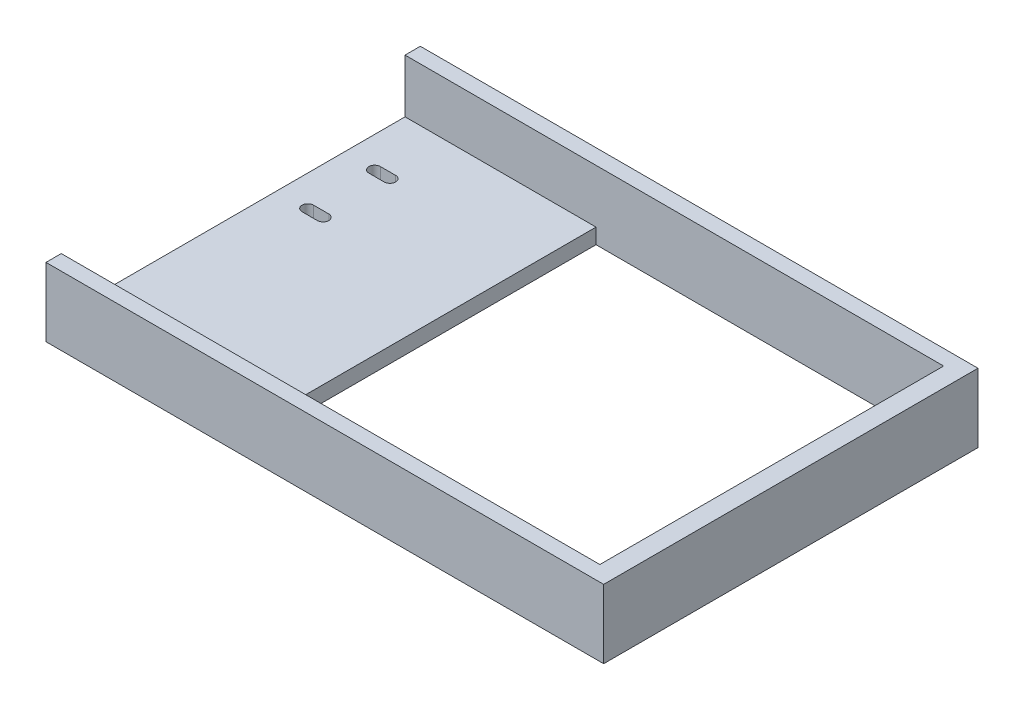
from build123d import *

# Parameters (mm, degrees)
SKETCH_1_W          = 146
SKETCH_1_H          = 98
EXTRUDE_1_DEPTH     = 18
SKETCH_2_W          = 141
SKETCH_2_H          = 90
CUT_EXTRUDE_1_DEPTH = 14
SKETCH_3_W          = 91
SKETCH_3_H          = 90
CUT_EXTRUDE_2_DEPTH = 17
CUT_EXTRUDE_3_DEPTH = 17


with BuildPart() as part:
    # 草图1 → 凸台-拉伸1 (new body)
    with BuildSketch(Plane(origin=(0, 0, 0), x_dir=(1, 0, 0), z_dir=(0, 1, 0))):
        with Locations((-12.96875, -2.625)):
            Rectangle(SKETCH_1_W, SKETCH_1_H)
    extrude(amount=EXTRUDE_1_DEPTH)

    # 草图2 → 切除-拉伸1 (cut)
    with BuildSketch(Plane(origin=(0, 18, 0), x_dir=(1, 0, 0), z_dir=(0, 1, 0))):
        with Locations((-15.46875, -2.625)):
            Rectangle(SKETCH_2_W, SKETCH_2_H)
    extrude(amount=-CUT_EXTRUDE_1_DEPTH, mode=Mode.SUBTRACT)

    # 草图3 → 切除-拉伸2 (cut)
    with BuildSketch(Plane(origin=(0, 4, 0), x_dir=(1, 0, 0), z_dir=(0, 1, 0))):
        with Locations((9.53125, -2.625)):
            Rectangle(SKETCH_3_W, SKETCH_3_H)
    extrude(amount=-CUT_EXTRUDE_2_DEPTH, mode=Mode.SUBTRACT)

    # 草图5 → 切除-拉伸3 (cut)
    with BuildSketch(Plane(origin=(0, 4, 0), x_dir=(1, 0, 0), z_dir=(0, 1, 0))):
        with BuildLine():
            Line((-73.931388989, 24.875), (-77.931388989, 24.875))
            ThreePointArc((-77.931388989, 24.875), (-79.431388989, 26.375), (-77.931388989, 27.875))
            Line((-77.931388989, 27.875), (-73.931388989, 27.875))
            ThreePointArc((-73.931388989, 27.875), (-72.431388989, 26.375), (-73.931388989, 24.875))
        make_face()
        with BuildLine():
            Line((-73.931388989, 7.375), (-77.931388989, 7.375))
            ThreePointArc((-77.931388989, 7.375), (-79.431388989, 8.875), (-77.931388989, 10.375))
            Line((-77.931388989, 10.375), (-73.931388989, 10.375))
            ThreePointArc((-73.931388989, 10.375), (-72.431388989, 8.875), (-73.931388989, 7.375))
        make_face()
    extrude(amount=-CUT_EXTRUDE_3_DEPTH, mode=Mode.SUBTRACT)


solid = part.part
